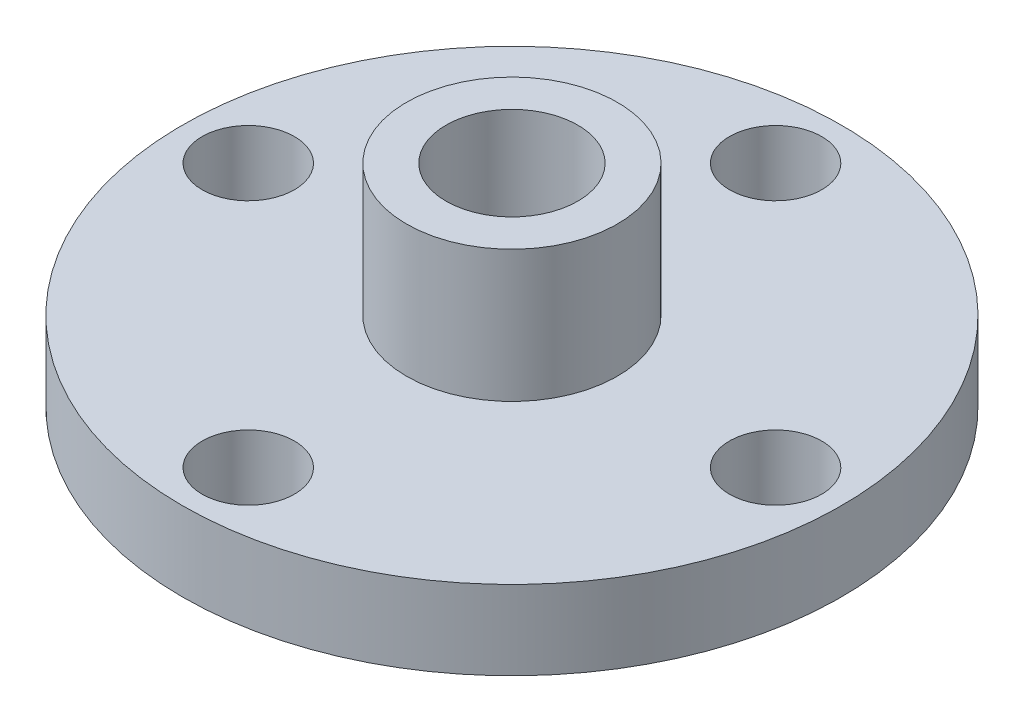
from build123d import *

# Parameters (mm, degrees)
SKETCH_1_R      = 12.5
SKETCH_1_R_2    = 2.5
SKETCH_1_R_3    = 1.75
EXTRUDE_1_DEPTH = 3
SKETCH_2_R      = 4
SKETCH_2_R_2    = 2.5
EXTRUDE_2_DEPTH = 5


with BuildPart() as part:
    # 草图1 → 凸台-拉伸1 (new body)
    with BuildSketch(Plane(origin=(0, 0, 0), x_dir=(1, 0, 0), z_dir=(0, 1, 0))):
        with Locations(Location((0, 0, 0), (0, 0, 270))):
            Circle(SKETCH_1_R)
        with Locations(Location((0, 0, 0), (0, 0, 270))):
            Circle(SKETCH_1_R_2, mode=Mode.SUBTRACT)
        with Locations(Location((0, 10, 0), (0, 0, 270))):
            Circle(SKETCH_1_R_3, mode=Mode.SUBTRACT)
        with Locations(Location((10, 0, 0), (0, 0, 270))):
            Circle(SKETCH_1_R_3, mode=Mode.SUBTRACT)
        with Locations(Location((0, -10, 0), (0, 0, 270))):
            Circle(SKETCH_1_R_3, mode=Mode.SUBTRACT)
        with Locations(Location((-10, 0, 0), (0, 0, 270))):
            Circle(SKETCH_1_R_3, mode=Mode.SUBTRACT)
    extrude(amount=EXTRUDE_1_DEPTH)

    # 草图2 → 凸台-拉伸2 (add)
    with BuildSketch(Plane(origin=(0, 3, 0), x_dir=(1, 0, 0), z_dir=(0, 1, 0))):
        with Locations(Location((0, 0, 0), (0, 0, 270))):
            Circle(SKETCH_2_R)
        with Locations(Location((0, 0, 0), (0, 0, 270))):
            Circle(SKETCH_2_R_2, mode=Mode.SUBTRACT)
    extrude(amount=EXTRUDE_2_DEPTH)


solid = part.part
